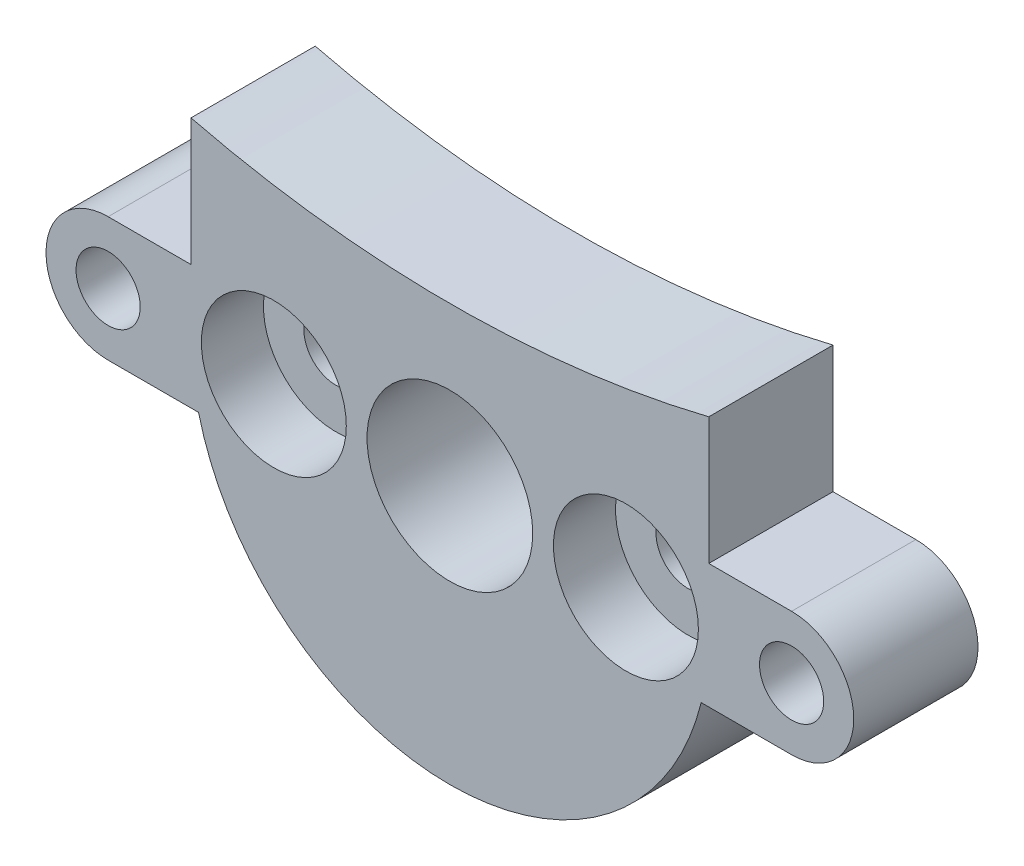
from build123d import *

# Parameters (mm, degrees)
SKETCH1_R           = 1.55
SKETCH1_R_2         = 4
BOSS_EXTRUDE1_DEPTH = 6
SKETCH2_R           = 3.5
CUT_EXTRUDE1_DEPTH  = 3


with BuildPart() as part:
    # Sketch1 → Boss-Extrude1 (new body)
    with BuildSketch(Plane.XY):
        with BuildLine():
            Line((-16.5, 3), (-12.5, 3))
            Line((-12.5, 3), (-12.5, 9.132525127))
            ThreePointArc((-12.5, 9.132525127), (0, 7.619182901), (12.5, 9.132525127))
            Line((12.5, 9.132525127), (12.5, 3))
            Line((12.5, 3), (16.5, 3))
            ThreePointArc((16.5, 3), (19.5, 0), (16.5, -3))
            Line((16.5, -3), (12.1346611, -3))
            ThreePointArc((12.1346611, -3), (0, -12.5), (-12.1346611, -3))
            Line((-12.1346611, -3), (-16.5, -3))
            ThreePointArc((-16.5, -3), (-19.5, 0), (-16.5, 3))
        make_face()
        with Locations((-8.5, 0)):
            Circle(SKETCH1_R, mode=Mode.SUBTRACT)
        with Locations((8.5, 0)):
            Circle(SKETCH1_R, mode=Mode.SUBTRACT)
        Circle(SKETCH1_R_2, mode=Mode.SUBTRACT)
        with Locations((-16.5, 0)):
            Circle(SKETCH1_R, mode=Mode.SUBTRACT)
        with Locations((16.5, 0)):
            Circle(SKETCH1_R, mode=Mode.SUBTRACT)
    extrude(amount=BOSS_EXTRUDE1_DEPTH)

    # Sketch2 → Cut-Extrude1 (cut)
    with BuildSketch(Plane.XY.offset(6)):
        with Locations((-8.5, 0)):
            Circle(SKETCH2_R)
        with Locations((8.5, 0)):
            Circle(SKETCH2_R)
    extrude(amount=-CUT_EXTRUDE1_DEPTH, mode=Mode.SUBTRACT)


solid = part.part
